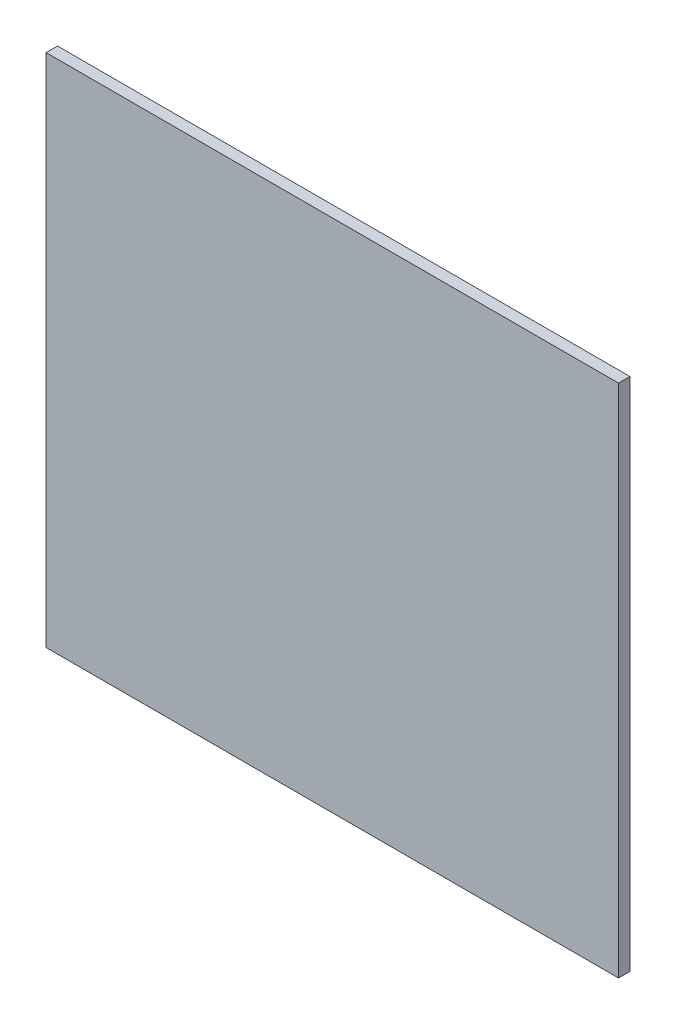
from build123d import *

# Parameters (mm, degrees)
SKETCH1_W           = 200
SKETCH1_H           = 180
BOSS_EXTRUDE1_DEPTH = 4


with BuildPart() as part:
    # Sketch1 → Boss-Extrude1 (new body)
    with BuildSketch(Plane.XY):
        Rectangle(SKETCH1_W, SKETCH1_H)
    extrude(amount=BOSS_EXTRUDE1_DEPTH)


solid = part.part
